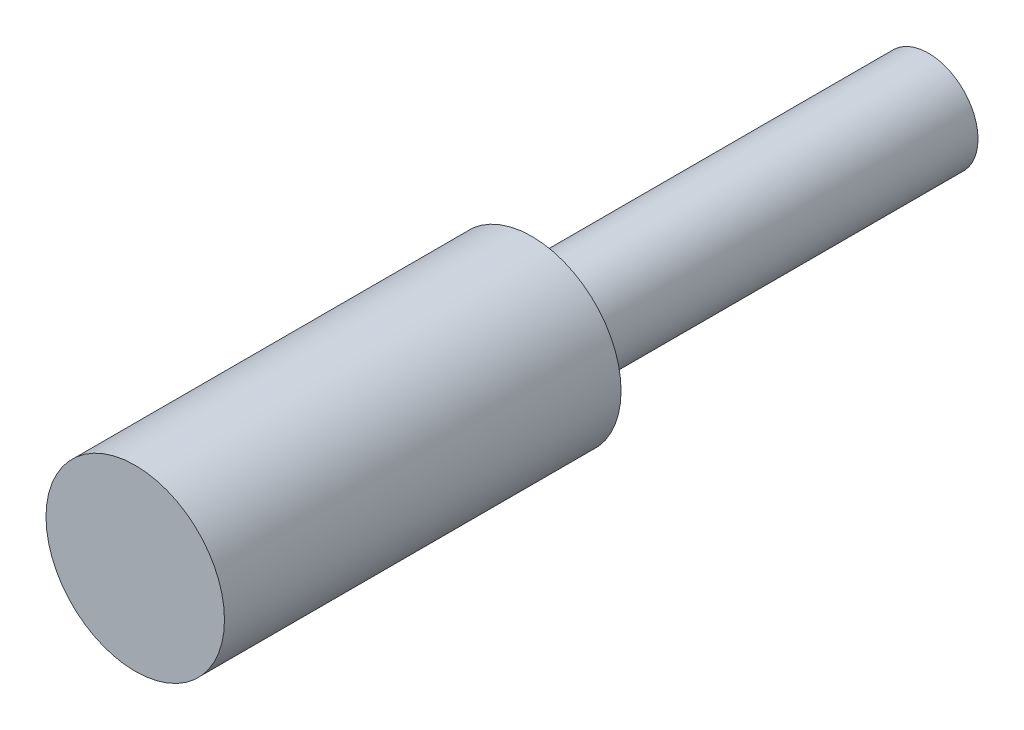
from build123d import *

# Parameters (mm, degrees)
SKETCH1_R           = 2.5
BOSS_EXTRUDE1_DEPTH = 20
SKETCH2_R           = 4.5
BOSS_EXTRUDE2_DEPTH = 20


with BuildPart() as part:
    # Sketch1 → Boss-Extrude1 (new body)
    with BuildSketch(Plane.XY):
        Circle(SKETCH1_R)
    extrude(amount=BOSS_EXTRUDE1_DEPTH)

    # Sketch2 → Boss-Extrude2 (add)
    with BuildSketch(Plane.XY.offset(20)):
        Circle(SKETCH2_R)
    extrude(amount=BOSS_EXTRUDE2_DEPTH)


solid = part.part
